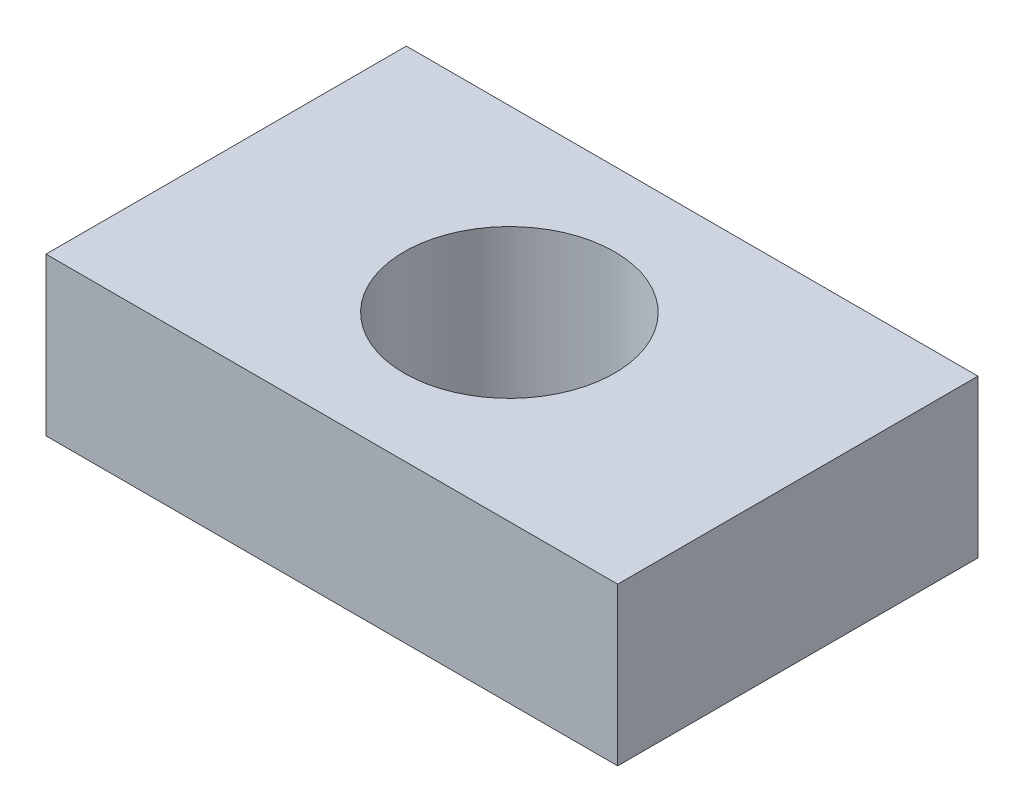
from build123d import *

# Parameters (mm, degrees)
SKETCH1_W           = 156.188100841
SKETCH1_H           = 98.444618116
SKETCH1_R           = 28.747301562
BOSS_EXTRUDE2_DEPTH = 43


with BuildPart() as part:
    # Sketch1 → Boss-Extrude2 (new body)
    with BuildSketch(Plane(origin=(0, 0, 0), x_dir=(1, 0, 0), z_dir=(0, 1, 0))):
        with Locations((9.72416289, -14.135123375)):
            Rectangle(SKETCH1_W, SKETCH1_H)
        with Locations(Location((8.733499551, -13.863432066, 0), (0, 0, 270))):
            Circle(SKETCH1_R, mode=Mode.SUBTRACT)
    extrude(amount=BOSS_EXTRUDE2_DEPTH)


solid = part.part
